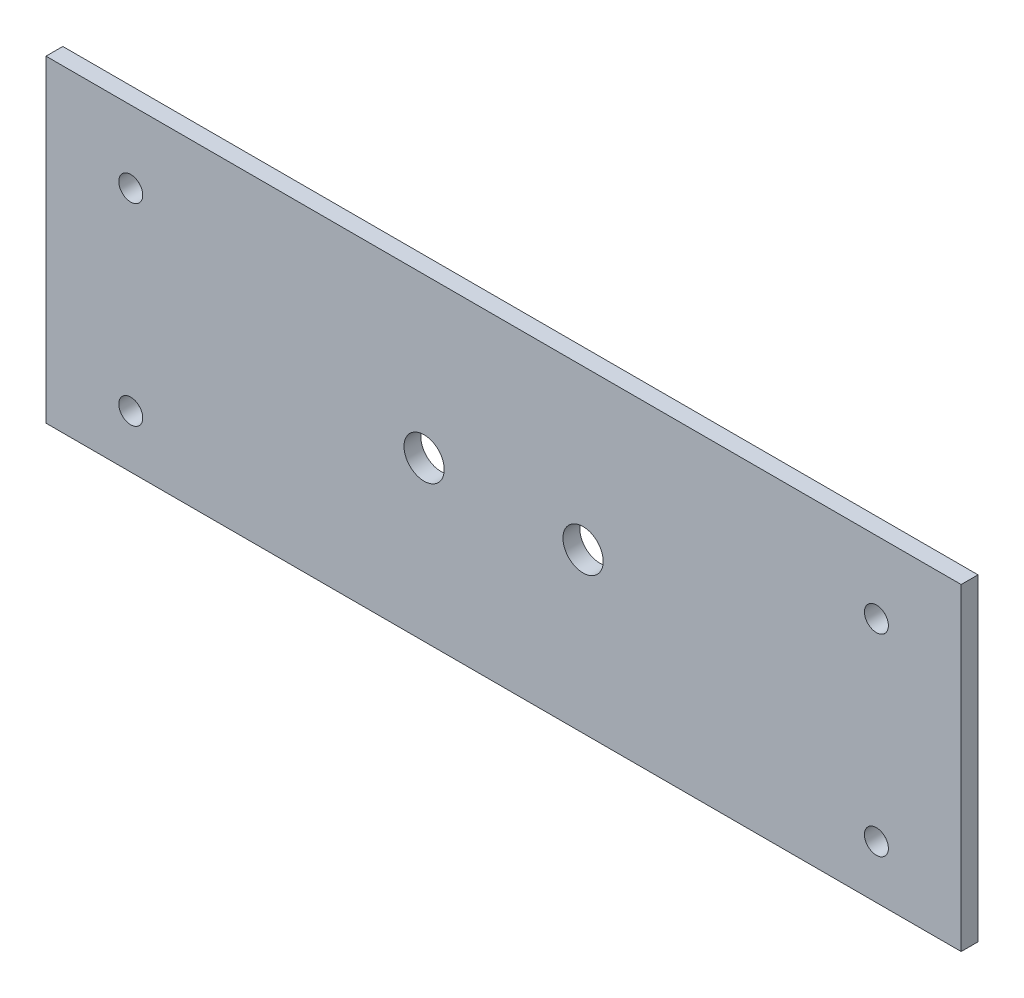
from build123d import *

# Parameters (mm, degrees)
SKETCH2_W             = 86.37
SKETCH2_H             = 30
BOSS_EXTRUDE1_DEPTH   = 1.5875
F_1_CLEARANCE_HOLE1_D = 2.2606
F_6_CLEARANCE_HOLE1_D = 3.7973


with BuildPart() as part:
    # Sketch2 → Boss-Extrude1 (new body)
    with BuildSketch(Plane.XY):
        with Locations((0, 15)):
            Rectangle(SKETCH2_W, SKETCH2_H)
    extrude(amount=BOSS_EXTRUDE1_DEPTH)

    # #1 Clearance Hole1 (through all)
    with Locations(Plane.XY.offset(1.5875)):
        with Locations((35.185, 23.2), (35.185, 5), (-35.185, 5), (-35.185, 23.2)):
            Hole(F_1_CLEARANCE_HOLE1_D / 2)

    # #6 Clearance Hole1 (through all)
    with Locations(Plane(origin=(0, 0, 0), x_dir=(-1, 0, 0), z_dir=(0, 0, -1))):
        with Locations((7.5, 15), (-7.5, 15)):
            Hole(F_6_CLEARANCE_HOLE1_D / 2)


solid = part.part
